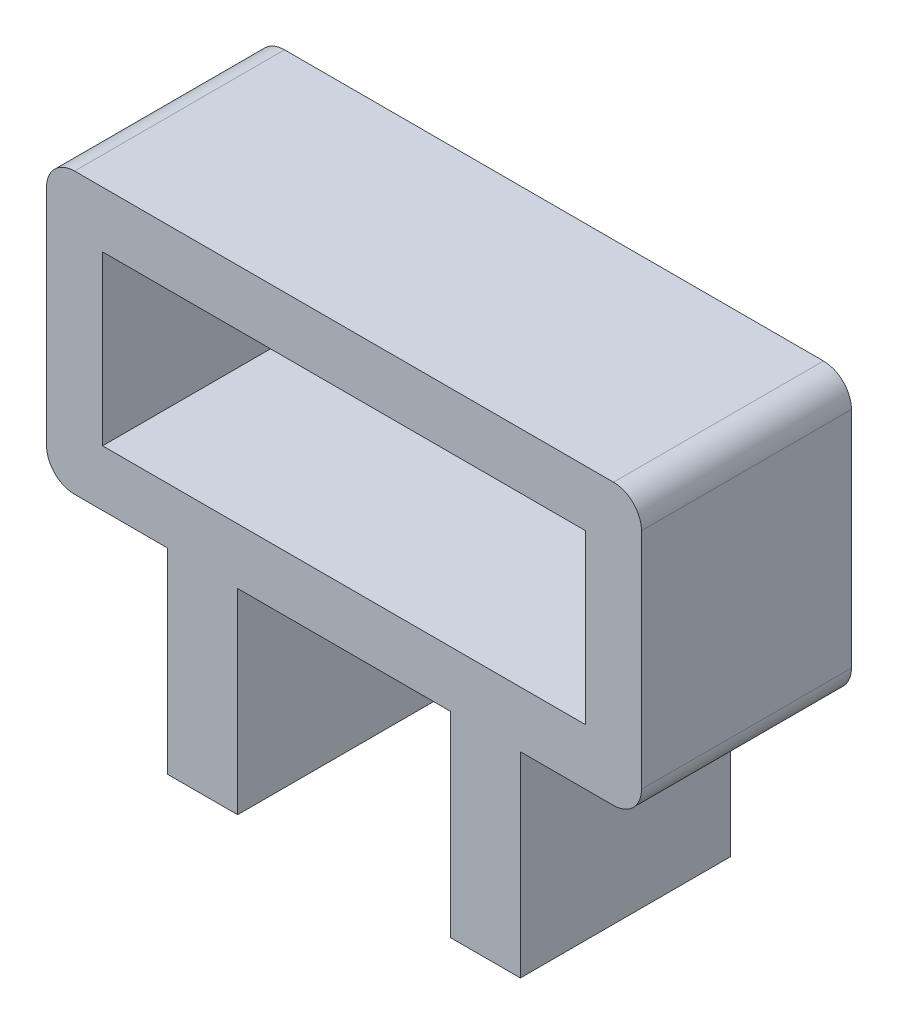
from build123d import *

# Parameters (mm, degrees)
SKETCH1_W           = 34.5
SKETCH1_H           = 12
BOSS_EXTRUDE1_DEPTH = 15
FILLET1_R           = 2


with BuildPart() as part:
    # Sketch1 → Boss-Extrude1 (new body)
    with BuildSketch(Plane.XY):
        Polygon((-40.804717196, 20.437010324), (1.695282804, 20.437010324), (1.695282804, 0.437010324), (-6.954717196, 0.437010324), (-6.954717196, -13.562989676), (-11.954717196, -13.562989676), (-11.954717196, 0.437010324), (-27.154717196, 0.437010324), (-27.154717196, -13.562989676), (-32.154717196, -13.562989676), (-32.154717196, 0.437010324), (-40.804717196, 0.437010324), align=None)
        with Locations((-19.554717196, 10.437010324)):
            Rectangle(SKETCH1_W, SKETCH1_H, mode=Mode.SUBTRACT)
    extrude(amount=BOSS_EXTRUDE1_DEPTH)

    # Fillet1
    fillet1_edges = [part.edges().sort_by_distance(p)[0] for p in [
        (-40.804717196, 0.437010324, 7.5),
        (-40.804717196, 20.437010324, 7.5),
        (1.695282804, 20.437010324, 7.5),
        (1.695282804, 0.437010324, 7.5),
    ]]
    fillet(fillet1_edges, radius=FILLET1_R)


solid = part.part
